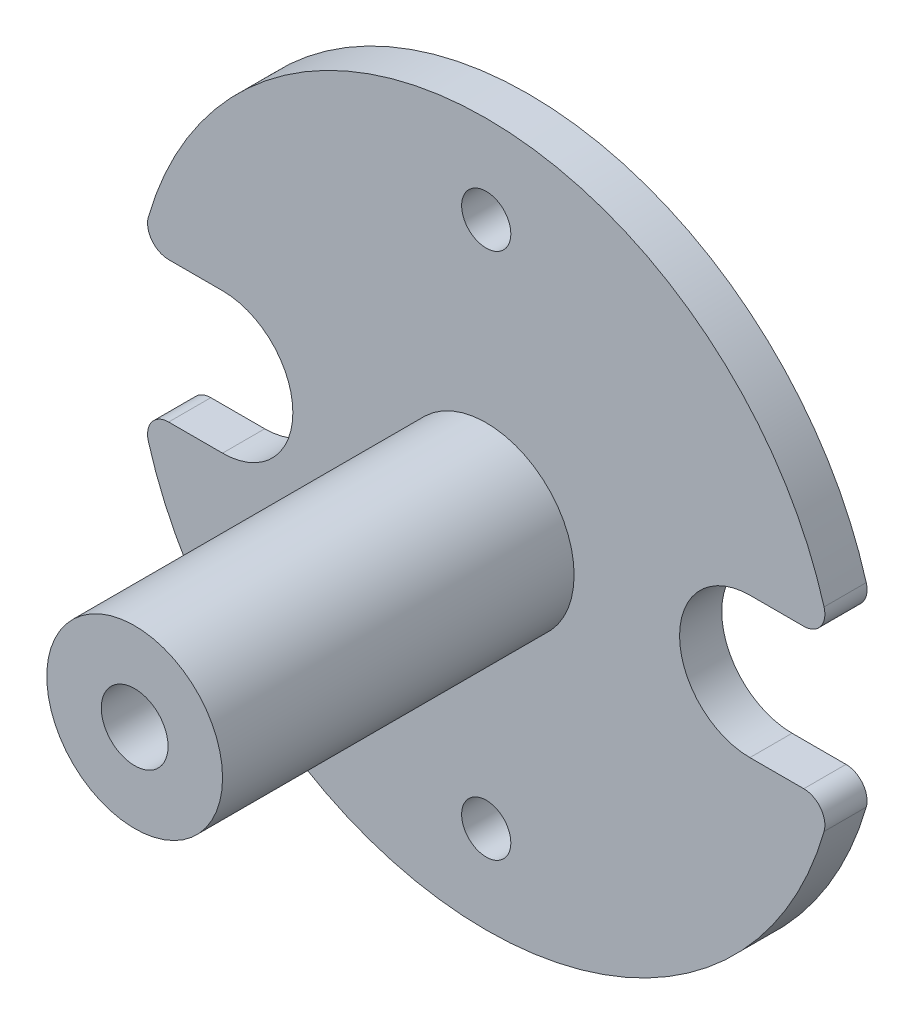
from build123d import *

# Parameters (mm, degrees)
CUT_EXTRUDE2_START = -5.08
SKETCH2_R          = 1.778
CUT_EXTRUDE2_DEPTH = 5.08
SKETCH4_R          = 2.413
CUT_EXTRUDE3_DEPTH = 19.05
FILLET1_R          = 1.524


with BuildPart() as part:
    # Sketch1 → Revolve1 (revolve)
    with BuildSketch(Plane(origin=(0, 0, 0), x_dir=(1, 0, 0), z_dir=(0, 1, 0))):
        Polygon((2.701636364, 33.504909091), (2.701636364, 30.456909091), (-16.348363636, 30.456909091), (-16.348363636, 5.056909091), (-22.698363636, 5.056909091), (-22.698363636, 33.504909091), align=None)
    revolve(axis=Axis((-22.698363636, 0, -5.056909091), (0, 0, -1)))

    # Sketch2 → Cut-Extrude2 (cut)
    with BuildSketch(Plane(origin=(0, 0, -33.504909091), x_dir=(-1, 0, 0), z_dir=(0, 0, -1)).offset(CUT_EXTRUDE2_START)):
        with Locations((22.698363636, -19.05)):
            Circle(SKETCH2_R)
        with Locations((22.698363636, 19.05)):
            Circle(SKETCH2_R)
        with BuildLine():
            Line((41.748363636, -5.08), (47.585179423, -5.08))
            ThreePointArc((47.585179423, -5.08), (48.098363636, 0), (47.585179423, 5.08))
            Line((47.585179423, 5.08), (41.748363636, 5.08))
            ThreePointArc((41.748363636, 5.08), (36.668363636, 0), (41.748363636, -5.08))
        make_face()
        with BuildLine():
            Line((3.648363636, 5.08), (-2.18845215, 5.08))
            ThreePointArc((-2.18845215, 5.08), (-2.701636364, 0), (-2.18845215, -5.08))
            Line((-2.18845215, -5.08), (3.648363636, -5.08))
            ThreePointArc((3.648363636, -5.08), (8.728363636, 0), (3.648363636, 5.08))
        make_face()
    extrude(amount=CUT_EXTRUDE2_DEPTH, mode=Mode.SUBTRACT)

    # Sketch4 → Cut-Extrude3 (cut)
    with BuildSketch(Plane.XY.offset(-5.056909091)):
        with Locations((-22.698363636, 0)):
            Circle(SKETCH4_R)
    extrude(amount=-CUT_EXTRUDE3_DEPTH, mode=Mode.SUBTRACT)

    # Fillet1
    fillet1_edges = [part.edges().sort_by_distance(p)[0] for p in [
        (-47.585179423, 5.08, -31.980909091),
        (-47.585179423, -5.08, -31.980909091),
        (2.18845215, -5.08, -31.980909091),
        (2.18845215, 5.08, -31.980909091),
    ]]
    fillet(fillet1_edges, radius=FILLET1_R)


solid = part.part
